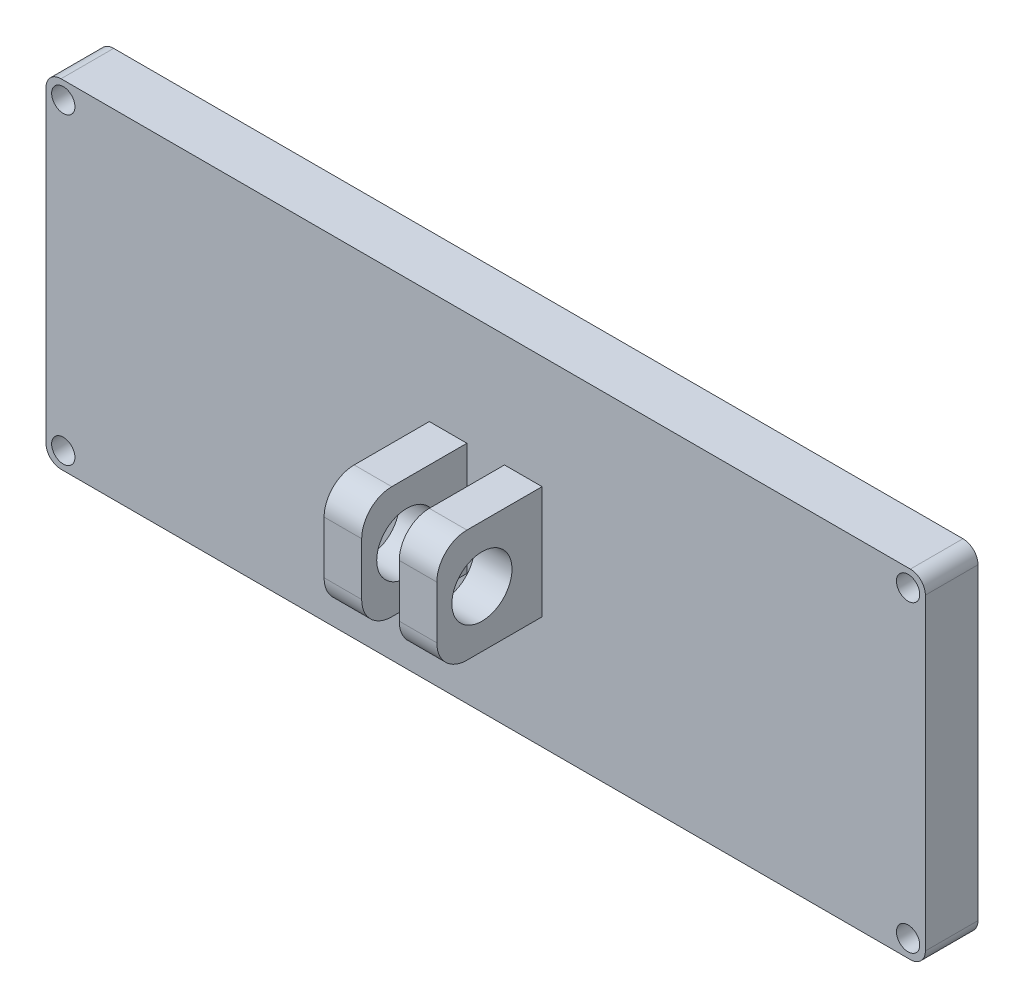
from build123d import *

# Parameters (mm, degrees)
SKETCH_1_W          = 117
SKETCH_1_H          = 45
EXTRUDE_1_DEPTH     = 7
FILLET_1_R          = 2
SKETCH_2_W          = 108.5
SKETCH_2_H          = 35.5
CUT_EXTRUDE_1_DEPTH = 5
SKETCH_3_R          = 1.55
CUT_EXTRUDE_2_DEPTH = 64.067424238
SKETCH_6_W          = 15
SKETCH_6_H          = 15
EXTRUDE_2_DEPTH     = 14
SKETCH_7_R          = 4
CUT_EXTRUDE_3_DEPTH = 73.823416564
FILLET_2_R          = 4
SKETCH_8_W          = 5
SKETCH_8_H          = 15
CUT_EXTRUDE_4_DEPTH = 20
SKETCH_9_W          = 20
SKETCH_9_H          = 35.5
EXTRUDE_3_DEPTH     = 1.5


with BuildPart() as part:
    # 草图1 → 凸台-拉伸1 (new body)
    with BuildSketch(Plane.XY):
        Rectangle(SKETCH_1_W, SKETCH_1_H)
    extrude(amount=EXTRUDE_1_DEPTH)

    # 圆角1
    fillet_1_edges = [part.edges().sort_by_distance(p)[0] for p in [
        (58.5, -22.5, 3.5),
        (-58.5, -22.5, 3.5),
        (-58.5, 22.5, 3.5),
        (58.5, 22.5, 3.5),
    ]]
    fillet(fillet_1_edges, radius=FILLET_1_R)

    # 草图2 → 切除-拉伸1 (cut)
    with BuildSketch(Plane(origin=(0, 0, 0), x_dir=(-1, 0, 0), z_dir=(0, 0, -1))):
        Rectangle(SKETCH_2_W, SKETCH_2_H)
    extrude(amount=-CUT_EXTRUDE_1_DEPTH, mode=Mode.SUBTRACT)

    # 草图3 → 切除-拉伸2 (cut, through all)
    with BuildSketch(Plane(origin=(0, 0, 0), x_dir=(-1, 0, 0), z_dir=(0, 0, -1))):
        with Locations((-56.2, 20.2)):
            Circle(SKETCH_3_R)
        with Locations(Location((-56.2, -20.2, 0), (0, 0, 180))):
            Circle(SKETCH_3_R)
        with Locations((56.2, -20.2)):
            Circle(SKETCH_3_R)
        with Locations(Location((56.2, 20.2, 0), (0, 0, 180))):
            Circle(SKETCH_3_R)
    extrude(amount=-CUT_EXTRUDE_2_DEPTH, mode=Mode.SUBTRACT)

    # 草图6 → 凸台-拉伸2 (add)
    with BuildSketch(Plane.XY.offset(7)):
        Rectangle(SKETCH_6_W, SKETCH_6_H)
    extrude(amount=EXTRUDE_2_DEPTH)

    # 草图7 → 切除-拉伸3 (cut, through all)
    with BuildSketch(Plane.ZY.offset(7.5)):
        with Locations((15, 0)):
            Circle(SKETCH_7_R)
    extrude(amount=-CUT_EXTRUDE_3_DEPTH, mode=Mode.SUBTRACT)

    # 圆角2
    fillet_2_edges = [part.edges().sort_by_distance(p)[0] for p in [
        (0, -7.5, 21),
        (0, 7.5, 21),
    ]]
    fillet(fillet_2_edges, radius=FILLET_2_R)

    # 草图8 → 切除-拉伸4 (cut)
    with BuildSketch(Plane.XY.offset(7)):
        Rectangle(SKETCH_8_W, SKETCH_8_H)
    extrude(amount=CUT_EXTRUDE_4_DEPTH, mode=Mode.SUBTRACT)

    # 草图9 → 凸台-拉伸3 (add)
    with BuildSketch(Plane(origin=(0, 0, 5), x_dir=(-1, 0, 0), z_dir=(0, 0, -1))):
        with Locations((-44.25, 0)):
            Rectangle(SKETCH_9_W, SKETCH_9_H)
        with Locations((44.25, 0)):
            Rectangle(SKETCH_9_W, SKETCH_9_H)
    extrude(amount=EXTRUDE_3_DEPTH)


solid = part.part
